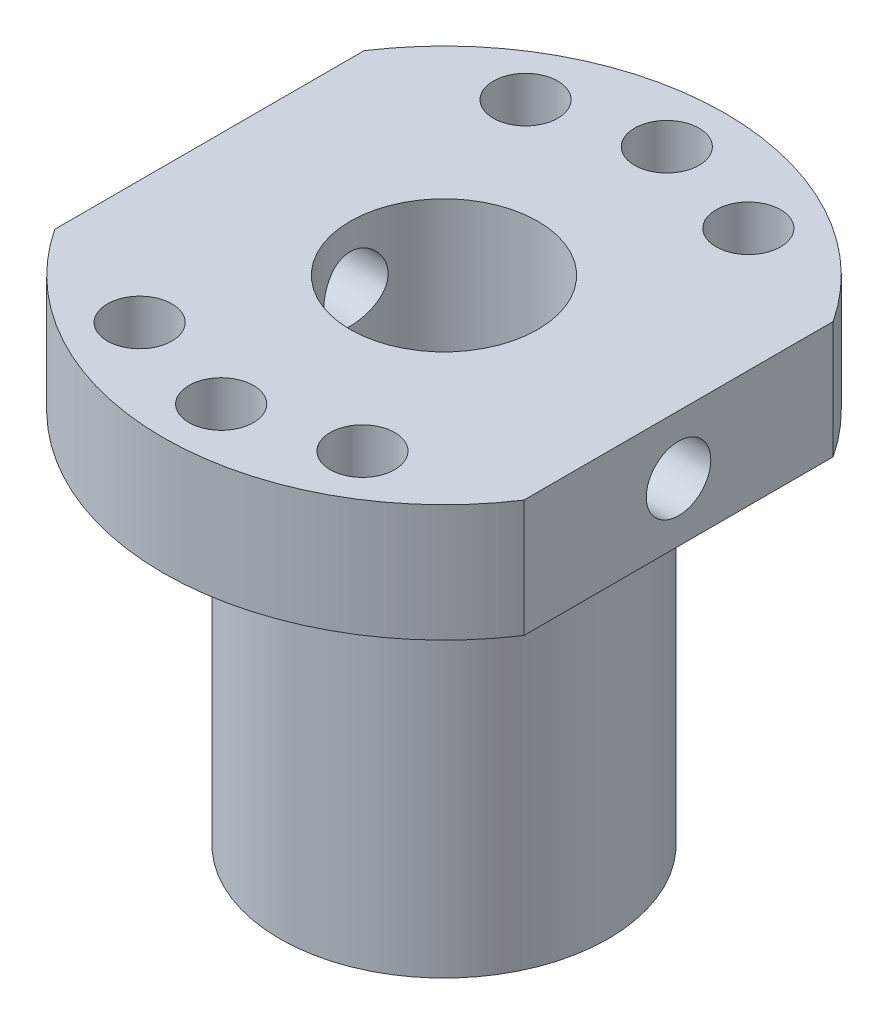
from build123d import *

# Parameters (mm, degrees)
SKETCH1_R           = 14
BOSS_EXTRUDE1_DEPTH = 32
BOSS_EXTRUDE2_DEPTH = 10
SKETCH6_R           = 8
CUT_EXTRUDE1_DEPTH  = 53.324865011
SKETCH8_R           = 2.75
CUT_EXTRUDE2_DEPTH  = 53.324865011
SKETCH9_R           = 2.75
CUT_EXTRUDE3_DEPTH  = 63.752621447


with BuildPart() as part:
    # Sketch1 → Boss-Extrude1 (new body)
    with BuildSketch(Plane(origin=(0, 0, 0), x_dir=(1, 0, 0), z_dir=(0, 1, 0))):
        with Locations(Location((0, 0, 0), (0, 0, 270))):
            Circle(SKETCH1_R)
    extrude(amount=BOSS_EXTRUDE1_DEPTH)

    # Sketch5 → Boss-Extrude2 (add)
    with BuildSketch(Plane(origin=(0, 32, 0), x_dir=(-1, 0, 0), z_dir=(0, 1, 0))):
        with BuildLine():
            Line((-20, 13.186792576), (-20, -13.186792576))
            ThreePointArc((-20, -13.186792576), (0, -23.956032611), (20, -13.186792576))
            Line((20, -13.186792576), (20, 13.186792576))
            ThreePointArc((20, 13.186792576), (0, 23.956032611), (-20, 13.186792576))
        make_face()
    extrude(amount=BOSS_EXTRUDE2_DEPTH)

    # Sketch6 → Cut-Extrude1 (cut, through all)
    with BuildSketch(Plane(origin=(0, 42, 0), x_dir=(-1, 0, 0), z_dir=(0, 1, 0))):
        with Locations(Location((0, 0, 0), (0, 0, 90))):
            Circle(SKETCH6_R)
    extrude(amount=-CUT_EXTRUDE1_DEPTH, mode=Mode.SUBTRACT)

    # Sketch8 → Cut-Extrude2 (cut, through all)
    with BuildSketch(Plane(origin=(0, 42, 0), x_dir=(-1, 0, 0), z_dir=(0, 1, 0))):
        with Locations(Location((0, 19, 0), (0, 0, 90))):
            Circle(SKETCH8_R)
        with Locations(Location((9.5, 16.454482672, 0), (0, 0, 90))):
            Circle(SKETCH8_R)
        with Locations(Location((9.5, -16.454482672, 0), (0, 0, 90))):
            Circle(SKETCH8_R)
        with Locations(Location((0, -19, 0), (0, 0, 90))):
            Circle(SKETCH8_R)
        with Locations(Location((-9.5, -16.454482672, 0), (0, 0, 90))):
            Circle(SKETCH8_R)
        with Locations(Location((-9.5, 16.454482672, 0), (0, 0, 90))):
            Circle(SKETCH8_R)
    extrude(amount=-CUT_EXTRUDE2_DEPTH, mode=Mode.SUBTRACT)

    # Sketch9 → Cut-Extrude3 (cut, through all)
    with BuildSketch(Plane(origin=(20, 0, 0), x_dir=(0, 0, -1), z_dir=(1, 0, 0))):
        with Locations((0, 37)):
            Circle(SKETCH9_R)
    extrude(amount=-CUT_EXTRUDE3_DEPTH, mode=Mode.SUBTRACT)


solid = part.part
